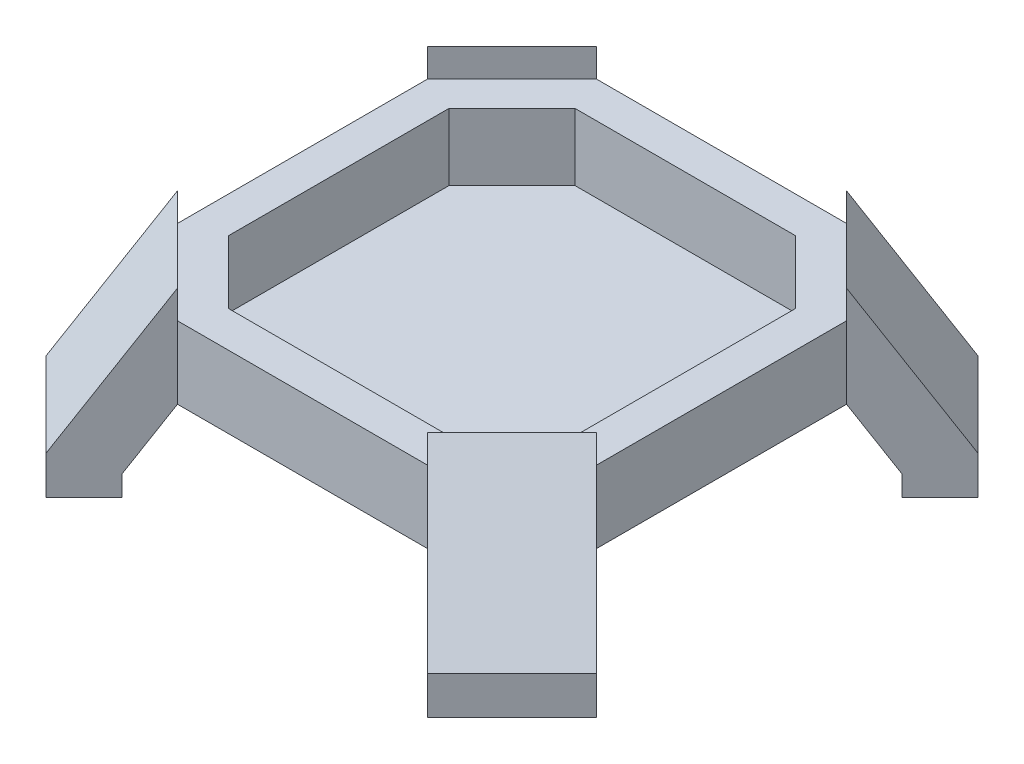
from build123d import *

# Parameters (mm, degrees)
BOSS_EXTRUDE1_DEPTH      = 20
SHELL1_T                 = -10
SHELL1_THICKNESS_2_DEPTH = 8.5
BOSS_EXTRUDE2_DEPTH      = 33
MIRROR2_COPY_1_DEPTH     = 33


with BuildPart() as part:
    # Sketch1 → Boss-Extrude1 (new body)
    with BuildSketch(Plane(origin=(0, 0, 0), x_dir=(1, 0, 0), z_dir=(0, 1, 0))):
        Polygon((24.894532576, 77.33756703), (48.229056355, 54.003043251), (48.229056355, -15.232403626), (24.894532576, -38.566927405), (-44.340914301, -38.566927405), (-67.675438081, -15.232403626), (-67.675438081, 54.003043251), (-44.340914301, 77.33756703), align=None)
    extrude(amount=BOSS_EXTRUDE1_DEPTH)

    # Shell1
    shell1_openings = [part.faces().sort_by_distance(p)[0] for p in [
        (-9.723190863, 20, -19.385319812),
    ]]
    offset(amount=SHELL1_T, openings=shell1_openings, kind=Kind.INTERSECTION)

    # Shell1 thickness 2 face (on inner face of the shell) → Shell1 thickness 2 (cut)
    with BuildSketch(Plane(origin=(-9.723190863, 10, -19.385319812), x_dir=(0, 0, -1), z_dir=(0, -1, 0))):
        Polygon((30.475587815, 47.952247218), (47.952247218, 30.475587815), (47.952247218, -30.475587815), (30.475587815, -47.952247218), (-30.475587814, -47.952247218), (-47.952247217, -30.475587815), (-47.952247217, 30.475587815), (-30.475587814, 47.952247218), align=None)
    extrude(amount=SHELL1_THICKNESS_2_DEPTH, mode=Mode.SUBTRACT)

    # Sketch3 → Boss-Extrude2 (add)
    with BuildSketch(Plane(origin=(-6.836197415, 0, 6.836197415), x_dir=(0, -1, 0), z_dir=(0.7071067811865477, 0, -0.7071067811865475))):
        Polygon((-27.824686591, 86.039679274), (11.738008985, 111.769453035), (22.303053884, 111.769453035), (22.303053884, 96.927374932), (16.741172808, 96.927374932), (0, 86.039679274), align=None)
    boss_extrude2 = extrude(amount=BOSS_EXTRUDE2_DEPTH)

    # Mirror1: Boss-Extrude2 across plane
    add(boss_extrude2.mirror(Plane.XY.offset(-19.385319812)))

    # Mirror2: Boss-Extrude2 across plane
    add(boss_extrude2.mirror(Plane.ZY.offset(9.723190863)))

    # Mirror2 copy 1 sketch → Mirror2 copy 1 (add)
    with BuildSketch(Plane(origin=(-12.610184311, 0, -45.60683704), x_dir=(0, -1, 0), z_dir=(-0.7071067811865477, 0, 0.7071067811865475))):
        Polygon((-27.824686591, 86.039679274), (11.738008985, 111.769453035), (22.303053884, 111.769453035), (22.303053884, 96.927374932), (16.741172808, 96.927374932), (0, 86.039679274), align=None)
    extrude(amount=MIRROR2_COPY_1_DEPTH)


solid = part.part
